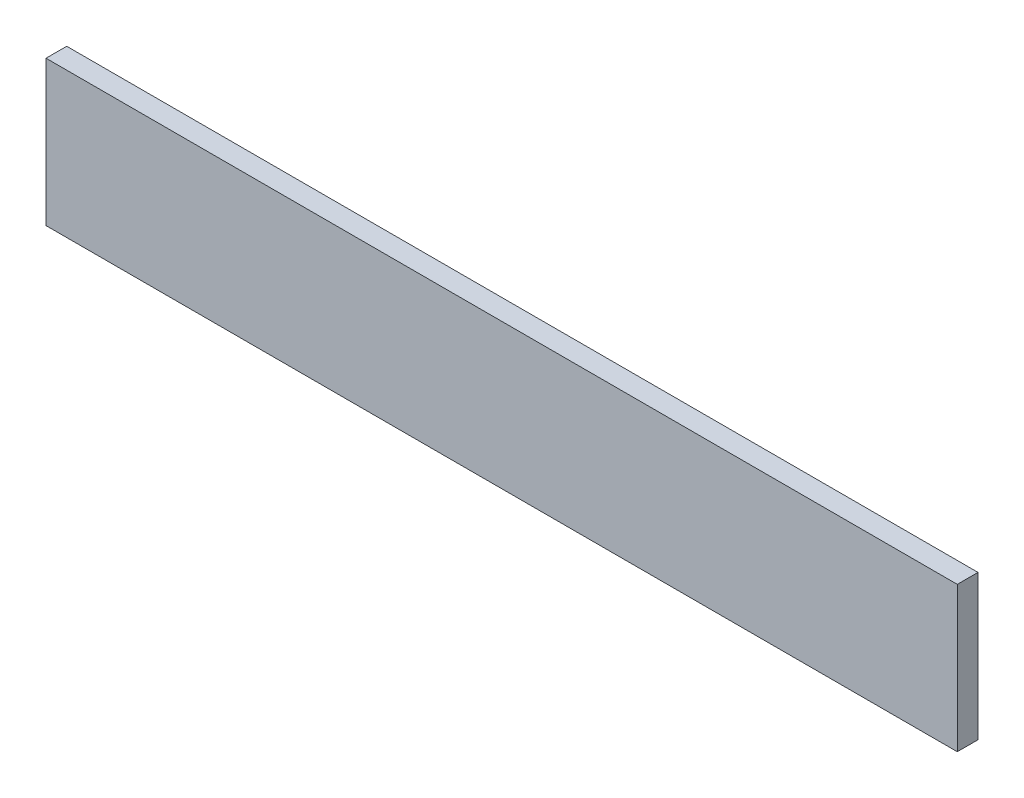
from build123d import *

# Parameters (mm, degrees)
SKETCH1_W           = 110
SKETCH1_H           = 17.5
BOSS_EXTRUDE1_DEPTH = 2.5


with BuildPart() as part:
    # Sketch1 → Boss-Extrude1 (new body)
    with BuildSketch(Plane.XY):
        with Locations((55, 8.75)):
            Rectangle(SKETCH1_W, SKETCH1_H)
    extrude(amount=BOSS_EXTRUDE1_DEPTH)


solid = part.part
